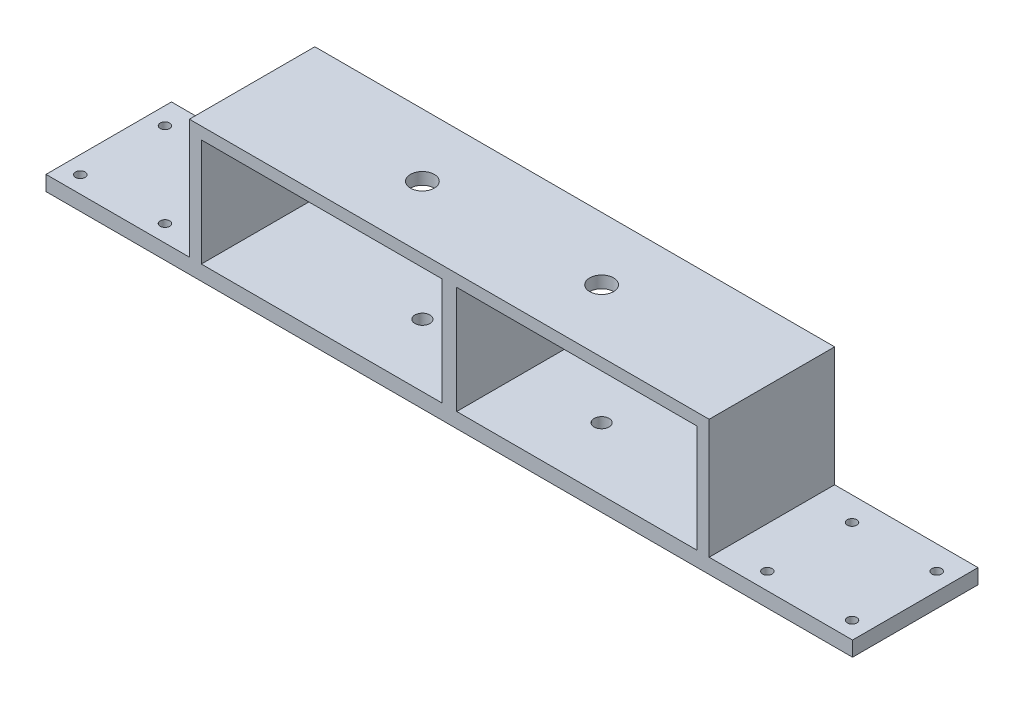
from build123d import *

# Parameters (mm, degrees)
SKETCH1_W           = 171.45
SKETCH1_H           = 26.67
SKETCH1_R           = 1.016
BOSS_EXTRUDE1_DEPTH = 3.175
SKETCH2_W           = 2.54
SKETCH2_H           = 26.67
BOSS_EXTRUDE2_DEPTH = 22.86
SKETCH3_W           = 26.67
SKETCH3_H           = 2.54
BOSS_EXTRUDE3_DEPTH = 110.49
SKETCH4_R           = 1.5875
CUT_EXTRUDE1_DEPTH  = 3.175
SKETCH5_R           = 2.54
CUT_EXTRUDE2_DEPTH  = 2.54
SKETCH6_W           = 3.175
SKETCH6_H           = 26.67
BOSS_EXTRUDE4_DEPTH = 22.86


with BuildPart() as part:
    # Sketch1 → Boss-Extrude1 (new body)
    with BuildSketch(Plane(origin=(0, 0, 0), x_dir=(1, 0, 0), z_dir=(0, 1, 0))):
        with Locations((0, 13.335)):
            Rectangle(SKETCH1_W, SKETCH1_H)
        with Locations(Location((64.025, 21.59, 0), (0, 0, 270))):
            Circle(SKETCH1_R, mode=Mode.SUBTRACT)
        with Locations(Location((82.025, 21.59, 0), (0, 0, 270))):
            Circle(SKETCH1_R, mode=Mode.SUBTRACT)
        with Locations(Location((64.025, 3.59, 0), (0, 0, 270))):
            Circle(SKETCH1_R, mode=Mode.SUBTRACT)
        with Locations(Location((82.025, 3.59, 0), (0, 0, 270))):
            Circle(SKETCH1_R, mode=Mode.SUBTRACT)
        with Locations(Location((-82.025, 3.59, 0), (0, 0, 90))):
            Circle(SKETCH1_R, mode=Mode.SUBTRACT)
        with Locations(Location((-64.025, 3.59, 0), (0, 0, 90))):
            Circle(SKETCH1_R, mode=Mode.SUBTRACT)
        with Locations(Location((-82.025, 21.59, 0), (0, 0, 90))):
            Circle(SKETCH1_R, mode=Mode.SUBTRACT)
        with Locations(Location((-64.025, 21.59, 0), (0, 0, 90))):
            Circle(SKETCH1_R, mode=Mode.SUBTRACT)
    extrude(amount=BOSS_EXTRUDE1_DEPTH)

    # Sketch2 → Boss-Extrude2 (add)
    with BuildSketch(Plane(origin=(0, 3.175, 0), x_dir=(1, 0, 0), z_dir=(0, 1, 0))):
        with Locations((-53.975, 13.335)):
            Rectangle(SKETCH2_W, SKETCH2_H)
    boss_extrude2 = extrude(amount=BOSS_EXTRUDE2_DEPTH)

    # Mirror1: Boss-Extrude2 across plane
    add(boss_extrude2.mirror(Plane(origin=(0, 0, 0), x_dir=(0, 0, 1), z_dir=(1, 0, 0))))

    # Sketch3 → Boss-Extrude3 (add)
    with BuildSketch(Plane.ZY.offset(55.245)):
        with Locations((-13.335, 27.305)):
            Rectangle(SKETCH3_W, SKETCH3_H)
    extrude(amount=-BOSS_EXTRUDE3_DEPTH)

    # Sketch4 → Cut-Extrude1 (cut)
    with BuildSketch(Plane(origin=(0, 3.175, 0), x_dir=(1, 0, 0), z_dir=(0, 1, 0))):
        with Locations(Location((-19.05, 13.335, 0), (0, 0, 270))):
            Circle(SKETCH4_R)
        with Locations(Location((19.05, 13.335, 0), (0, 0, 270))):
            Circle(SKETCH4_R)
    extrude(amount=-CUT_EXTRUDE1_DEPTH, mode=Mode.SUBTRACT)

    # Sketch5 → Cut-Extrude2 (cut)
    with BuildSketch(Plane(origin=(0, 28.575, 0), x_dir=(1, 0, 0), z_dir=(0, 1, 0))):
        with Locations(Location((-19.05, 13.335, 0), (0, 0, 270))):
            Circle(SKETCH5_R)
        with Locations(Location((19.05, 13.335, 0), (0, 0, 270))):
            Circle(SKETCH5_R)
    extrude(amount=-CUT_EXTRUDE2_DEPTH, mode=Mode.SUBTRACT)

    # Sketch6 → Boss-Extrude4 (add)
    with BuildSketch(Plane(origin=(0, 3.175, 0), x_dir=(1, 0, 0), z_dir=(0, 1, 0))):
        with Locations((0, 13.335)):
            Rectangle(SKETCH6_W, SKETCH6_H)
    extrude(amount=BOSS_EXTRUDE4_DEPTH)


solid = part.part
